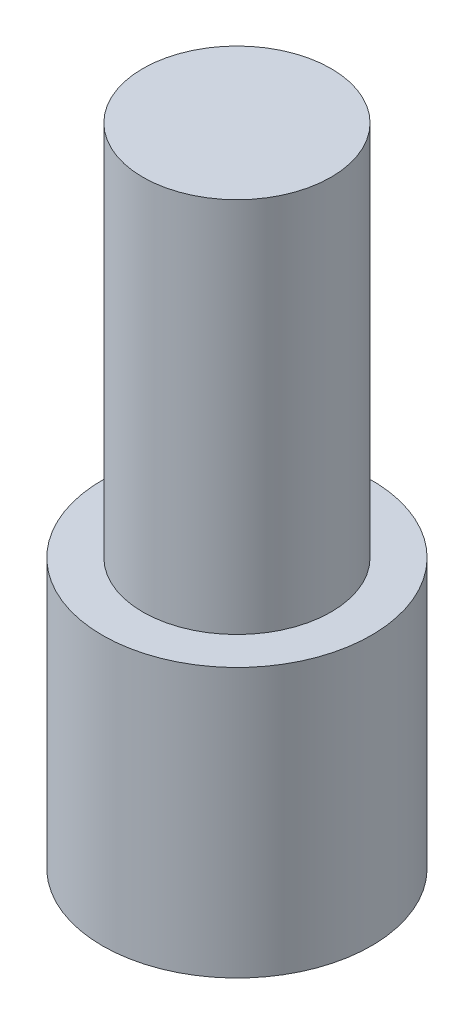
from build123d import *

# Parameters (mm, degrees)
SKETCH1_R           = 2.5
BOSS_EXTRUDE1_DEPTH = 5
SKETCH2_R           = 1.75
BOSS_EXTRUDE2_DEPTH = 7
SKETCH3_R           = 1.75
CUT_EXTRUDE1_DEPTH  = 3


with BuildPart() as part:
    # Sketch1 → Boss-Extrude1 (new body)
    with BuildSketch(Plane(origin=(0, 0, 0), x_dir=(1, 0, 0), z_dir=(0, 1, 0))):
        with Locations(Location((0, 0, 0), (0, 0, 270))):
            Circle(SKETCH1_R)
    extrude(amount=BOSS_EXTRUDE1_DEPTH)

    # Sketch2 → Boss-Extrude2 (add)
    with BuildSketch(Plane(origin=(0, 5, 0), x_dir=(1, 0, 0), z_dir=(0, 1, 0))):
        with Locations(Location((0, 0, 0), (0, 0, 270))):
            Circle(SKETCH2_R)
    extrude(amount=BOSS_EXTRUDE2_DEPTH)

    # Sketch3 → Cut-Extrude1 (cut)
    with BuildSketch(Plane.XZ):
        with Locations(Location((0, 0, 0), (0, 0, 90))):
            Circle(SKETCH3_R)
    extrude(amount=-CUT_EXTRUDE1_DEPTH, mode=Mode.SUBTRACT)


solid = part.part
